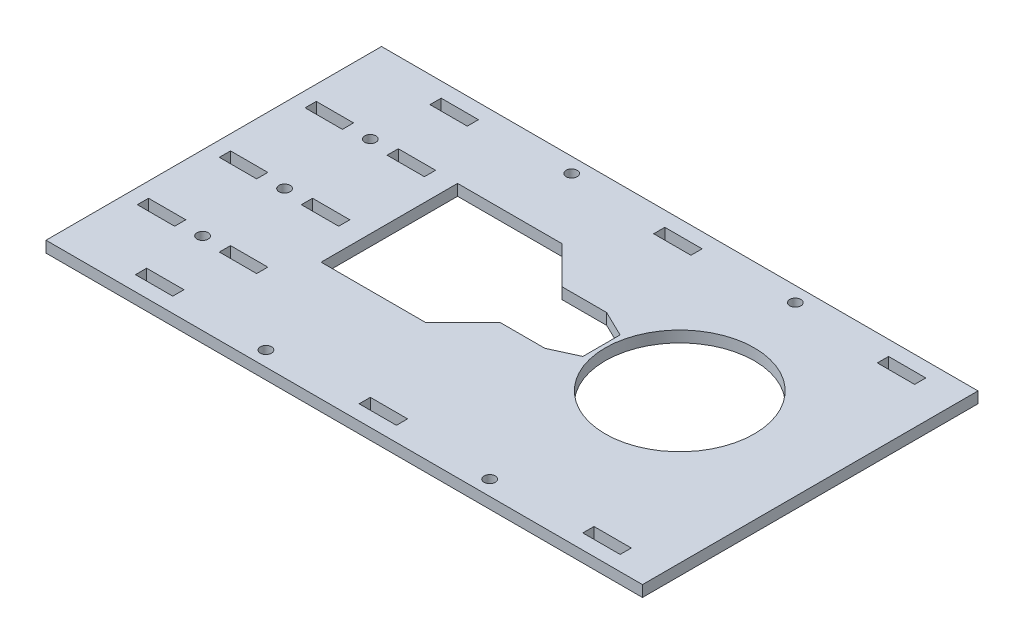
from build123d import *

# Parameters (mm, degrees)
SKETCH1_W           = 160
SKETCH1_H           = 90
SKETCH1_R           = 20
SKETCH1_R_2         = 1.5
SKETCH1_W_2         = 10
SKETCH1_H_2         = 3
BOSS_EXTRUDE1_DEPTH = 3


with BuildPart() as part:
    # Sketch1 → Boss-Extrude1 (new body)
    with BuildSketch(Plane(origin=(0, 0, 0), x_dir=(1, 0, 0), z_dir=(0, 1, 0))):
        with Locations((-80, 45)):
            Rectangle(SKETCH1_W, SKETCH1_H)
        with Locations(Location((-40, 50, 0), (0, 0, 270))):
            Circle(SKETCH1_R, mode=Mode.SUBTRACT)
        with Locations(Location((-105, 4, 0), (0, 0, 270))):
            Circle(SKETCH1_R_2, mode=Mode.SUBTRACT)
        with Locations(Location((-45, 4, 0), (0, 0, 270))):
            Circle(SKETCH1_R_2, mode=Mode.SUBTRACT)
        with Locations(Location((-105, 86, 0), (0, 0, 90))):
            Circle(SKETCH1_R_2, mode=Mode.SUBTRACT)
        with Locations(Location((-45, 86, 0), (0, 0, 90))):
            Circle(SKETCH1_R_2, mode=Mode.SUBTRACT)
        with Locations(Location((-140, 67, 0), (0, 0, 270))):
            Circle(SKETCH1_R_2, mode=Mode.SUBTRACT)
        with Locations(Location((-140, 44, 0), (0, 0, 90))):
            Circle(SKETCH1_R_2, mode=Mode.SUBTRACT)
        with Locations(Location((-140, 22, 0), (0, 0, 270))):
            Circle(SKETCH1_R_2, mode=Mode.SUBTRACT)
        Polygon((-118, 68.4), (-118, 31.8), (-90, 31.8), (-80, 41.8), (-68, 41.8), (-61, 45), (-61, 55), (-68, 58.4), (-80, 58.4), (-90, 68.4), align=None, mode=Mode.SUBTRACT)
        with Locations((-135, 84.5)):
            Rectangle(SKETCH1_W_2, SKETCH1_H_2, mode=Mode.SUBTRACT)
        with Locations((-135, 5.5)):
            Rectangle(SKETCH1_W_2, SKETCH1_H_2, mode=Mode.SUBTRACT)
        with Locations((-75, 5.5)):
            Rectangle(SKETCH1_W_2, SKETCH1_H_2, mode=Mode.SUBTRACT)
        with Locations((-75, 84.5)):
            Rectangle(SKETCH1_W_2, SKETCH1_H_2, mode=Mode.SUBTRACT)
        with Locations((-15, 5.5)):
            Rectangle(SKETCH1_W_2, SKETCH1_H_2, mode=Mode.SUBTRACT)
        with Locations((-15, 84.5)):
            Rectangle(SKETCH1_W_2, SKETCH1_H_2, mode=Mode.SUBTRACT)
        with Locations((-151, 67)):
            Rectangle(SKETCH1_W_2, SKETCH1_H_2, mode=Mode.SUBTRACT)
        with Locations((-129, 67)):
            Rectangle(SKETCH1_W_2, SKETCH1_H_2, mode=Mode.SUBTRACT)
        with Locations((-129, 44)):
            Rectangle(SKETCH1_W_2, SKETCH1_H_2, mode=Mode.SUBTRACT)
        with Locations((-151, 44)):
            Rectangle(SKETCH1_W_2, SKETCH1_H_2, mode=Mode.SUBTRACT)
        with Locations((-151, 22)):
            Rectangle(SKETCH1_W_2, SKETCH1_H_2, mode=Mode.SUBTRACT)
        with Locations((-129, 22)):
            Rectangle(SKETCH1_W_2, SKETCH1_H_2, mode=Mode.SUBTRACT)
    extrude(amount=BOSS_EXTRUDE1_DEPTH)


solid = part.part
